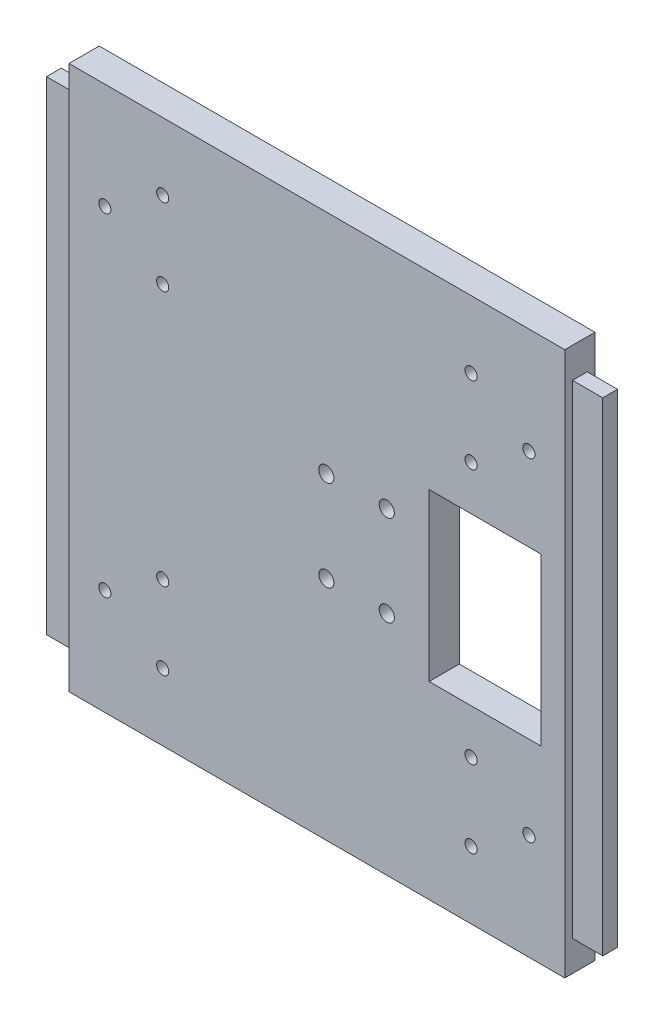
from build123d import *

# Parameters (mm, degrees)
SKETCH_1_W          = 164
SKETCH_1_H          = 180
EXTRUDE_1_DEPTH     = 10
SKETCH_2_W          = 4.88
SKETCH_2_H          = 159.88
EXTRUDE_2_DEPTH     = 10
SKETCH_3_R          = 2
CUT_EXTRUDE_1_DEPTH = 10
SKETCH_5_R          = 2.5
SKETCH_5_W          = 37
SKETCH_5_H          = 55
CUT_EXTRUDE_3_DEPTH = 8
SKETCH_6_W          = 37
SKETCH_6_H          = 55
CUT_EXTRUDE_4_DEPTH = 8


with BuildPart() as part:
    # 草图1 → 凸台-拉伸1 (new body)
    with BuildSketch(Plane.XY):
        with Locations((82, 90)):
            Rectangle(SKETCH_1_W, SKETCH_1_H)
    extrude(amount=EXTRUDE_1_DEPTH)

    # 草图2 → 凸台-拉伸2 (add)
    with BuildSketch(Plane.ZY):
        with Locations((5, 90)):
            Rectangle(SKETCH_2_W, SKETCH_2_H)
    extrude_2 = extrude(amount=EXTRUDE_2_DEPTH)

    # 镜向1: 凸台-拉伸2 across plane
    add(extrude_2.mirror(Plane(origin=(82, 0, 0), x_dir=(0, 0, 1), z_dir=(1, 0, 0))))

    # 草图3 → 切除-拉伸1 (cut)
    with BuildSketch(Plane(origin=(0, 0, 0), x_dir=(-1, 0, 0), z_dir=(0, 0, -1))):
        with Locations((-152.1425573, 145)):
            Circle(SKETCH_3_R)
        with Locations((-133, 157.75)):
            Circle(SKETCH_3_R)
        with Locations((-133, 132.25)):
            Circle(SKETCH_3_R)
        with Locations((-11.8574427, 145)):
            Circle(SKETCH_3_R)
        with Locations((-31, 157.75)):
            Circle(SKETCH_3_R)
        with Locations((-31, 132.25)):
            Circle(SKETCH_3_R)
        with Locations(Location((-133, 47.75, 0), (0, 0, 180))):
            Circle(SKETCH_3_R)
        with Locations(Location((-133, 22.25, 0), (0, 0, 180))):
            Circle(SKETCH_3_R)
        with Locations(Location((-152.1425573, 35, 0), (0, 0, 180))):
            Circle(SKETCH_3_R)
        with Locations(Location((-31, 47.75, 0), (0, 0, 180))):
            Circle(SKETCH_3_R)
        with Locations(Location((-31, 22.25, 0), (0, 0, 180))):
            Circle(SKETCH_3_R)
        with Locations(Location((-11.8574427, 35, 0), (0, 0, 180))):
            Circle(SKETCH_3_R)
    extrude(amount=-CUT_EXTRUDE_1_DEPTH, mode=Mode.SUBTRACT)

    # 草图5 → 切除-拉伸3 (cut)
    with BuildSketch(Plane.XY.offset(10)):
        with Locations((85.117863175, 105)):
            Circle(SKETCH_5_R)
        with Locations((85.117863175, 75)):
            Circle(SKETCH_5_R)
        with Locations((105.117863175, 105)):
            Circle(SKETCH_5_R)
        with Locations((105.117863175, 75)):
            Circle(SKETCH_5_R)
        with Locations((137.617863175, 90)):
            Rectangle(SKETCH_5_W, SKETCH_5_H)
    extrude(amount=-CUT_EXTRUDE_3_DEPTH, mode=Mode.SUBTRACT)

    # 草图6 → 切除-拉伸4 (cut)
    with BuildSketch(Plane.XY.offset(2)):
        with Locations((137.617863175, 90)):
            Rectangle(SKETCH_6_W, SKETCH_6_H)
    extrude(amount=-CUT_EXTRUDE_4_DEPTH, mode=Mode.SUBTRACT)


solid = part.part
